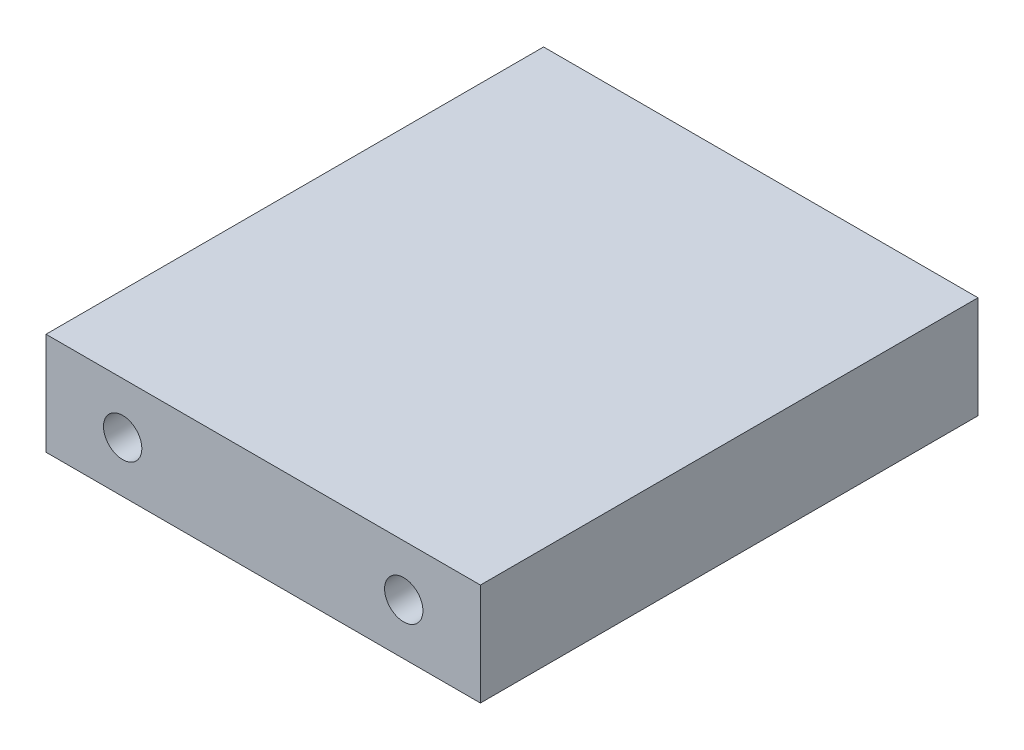
from build123d import *

# Parameters (mm, degrees)
SKETCH1_W           = 107.95
SKETCH1_H           = 25.4
BOSS_EXTRUDE1_DEPTH = 123.65
SKETCH2_R           = 4.7625
SKETCH2_R_2         = 4.765
CUT_EXTRUDE1_DEPTH  = 25.4


with BuildPart() as part:
    # Sketch1 → Boss-Extrude1 (new body)
    with BuildSketch(Plane.XY):
        with Locations((53.975, -12.7)):
            Rectangle(SKETCH1_W, SKETCH1_H)
    extrude(amount=BOSS_EXTRUDE1_DEPTH)

    # Sketch2 → Cut-Extrude1 (cut)
    with BuildSketch(Plane.XY.offset(123.65)):
        with Locations((19.05, -12.7)):
            Circle(SKETCH2_R)
        with Locations((88.9, -12.7)):
            Circle(SKETCH2_R_2)
    cut_extrude1 = extrude(amount=-CUT_EXTRUDE1_DEPTH, mode=Mode.SUBTRACT)

    # Mirror1: Cut-Extrude1 across plane
    add(cut_extrude1.mirror(Plane.XY.offset(61.825)), mode=Mode.SUBTRACT)


solid = part.part
